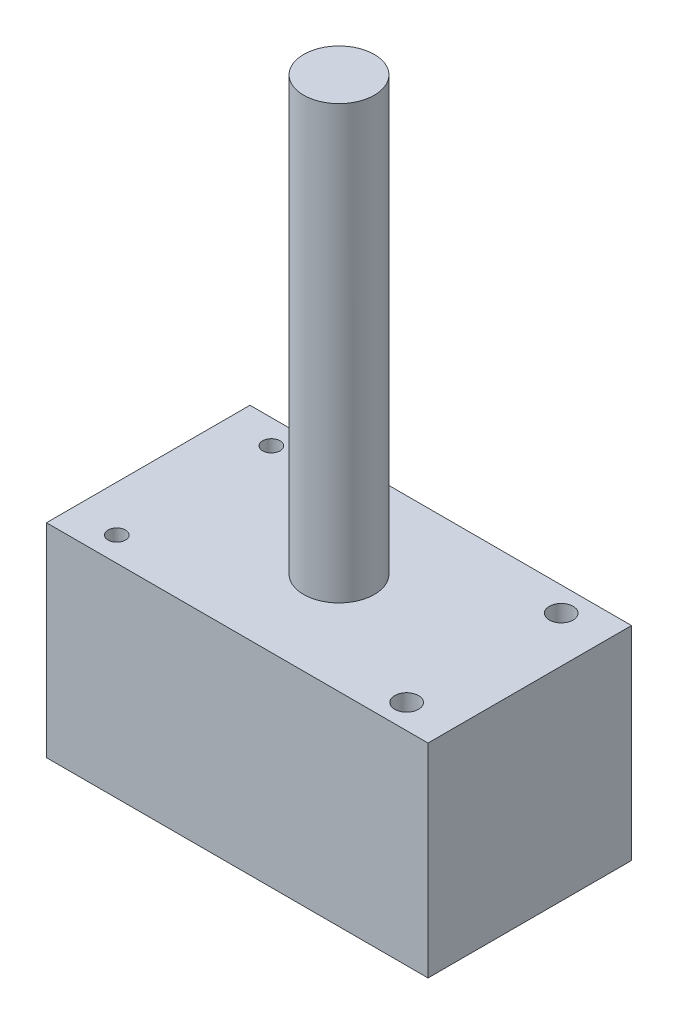
from build123d import *

# Parameters (mm, degrees)
F_01_HOUSING_PROFILE_W      = 135
F_01_HOUSING_PROFILE_H      = 72
F_01_HOUSING_PROFILE_R      = 3.090475378
F_01_HOUSING_PROFILE_R_2    = 4.219723183
F_01_HOUSING_BLOCK_DEPTH    = 72
F_03_OUTPUT_SHAFT_PROFILE_R = 12.5
F_03_OUTPUT_SHAFT_DEPTH     = 225


with BuildPart() as part:
    # 01_Housing_Profile → 01_Housing_Block (new body)
    with BuildSketch(Plane(origin=(0, 0, 0), x_dir=(1, 0, 0), z_dir=(0, 1, 0))):
        Rectangle(F_01_HOUSING_PROFILE_W, F_01_HOUSING_PROFILE_H)
        with Locations(Location((-51.280276817, -27.349480969, 0), (0, 0, 270))):
            Circle(F_01_HOUSING_PROFILE_R, mode=Mode.SUBTRACT)
        with Locations(Location((51.280276817, -27.349480969, 0), (0, 0, 270))):
            Circle(F_01_HOUSING_PROFILE_R_2, mode=Mode.SUBTRACT)
        with Locations(Location((-51.280276817, 27.349480969, 0), (0, 0, 270))):
            Circle(F_01_HOUSING_PROFILE_R, mode=Mode.SUBTRACT)
        with Locations(Location((51.280276817, 27.349480969, 0), (0, 0, 270))):
            Circle(F_01_HOUSING_PROFILE_R_2, mode=Mode.SUBTRACT)
    extrude(amount=F_01_HOUSING_BLOCK_DEPTH)

    # 03_Output_Shaft_Profile → 03_Output_Shaft (add)
    with BuildSketch(Plane(origin=(0, 0, 0), x_dir=(1, 0, 0), z_dir=(0, 1, 0))):
        with Locations(Location((0, 0, 0), (0, 0, 90))):
            Circle(F_03_OUTPUT_SHAFT_PROFILE_R)
    extrude(amount=F_03_OUTPUT_SHAFT_DEPTH)


solid = part.part
